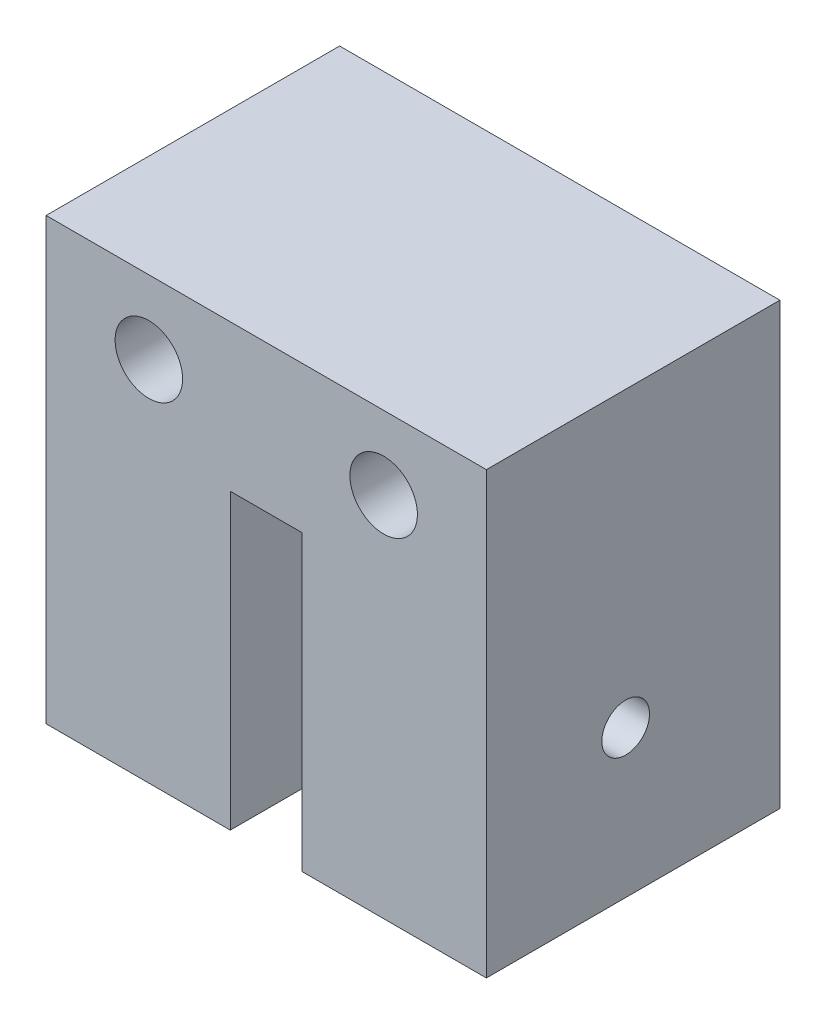
from build123d import *

# Parameters (mm, degrees)
SKETCH1_W           = 30
SKETCH1_H           = 20
BOSS_EXTRUDE1_DEPTH = 10
SKETCH3_W           = 12.55
SKETCH3_H           = 20
BOSS_EXTRUDE3_DEPTH = 20
SKETCH6_R           = 2.3
CUT_EXTRUDE1_DEPTH  = 33.015621187
SKETCH7_R           = 1.625
CUT_EXTRUDE2_DEPTH  = 141.678400141


with BuildPart() as part:
    # Sketch1 → Boss-Extrude1 (new body)
    with BuildSketch(Plane(origin=(0, 0, 0), x_dir=(1, 0, 0), z_dir=(0, 1, 0))):
        Rectangle(SKETCH1_W, SKETCH1_H)
    extrude(amount=BOSS_EXTRUDE1_DEPTH)

    # Sketch3 → Boss-Extrude3 (add)
    with BuildSketch(Plane.XZ):
        with Locations((8.725, 0)):
            Rectangle(SKETCH3_W, SKETCH3_H)
        with Locations((-8.725, 0)):
            Rectangle(SKETCH3_W, SKETCH3_H)
    extrude(amount=BOSS_EXTRUDE3_DEPTH)

    # Sketch6 → Cut-Extrude1 (cut, through all)
    with BuildSketch(Plane(origin=(0, 0, -10), x_dir=(-1, 0, 0), z_dir=(0, 0, -1))):
        with Locations((8, 5)):
            Circle(SKETCH6_R)
        with Locations((-8, 5)):
            Circle(SKETCH6_R)
    extrude(amount=-CUT_EXTRUDE1_DEPTH, mode=Mode.SUBTRACT)

    # Sketch7 → Cut-Extrude2 (cut, through all)
    with BuildSketch(Plane(origin=(-15, -86.420292381, -87.946615477), x_dir=(0, 1, 0), z_dir=(-1, 0, 0))):
        with Locations(Location((76.454314497, -88.455505565, 0), (0, 0, 270))):
            Circle(SKETCH7_R)
    extrude(amount=-CUT_EXTRUDE2_DEPTH, mode=Mode.SUBTRACT)


solid = part.part
